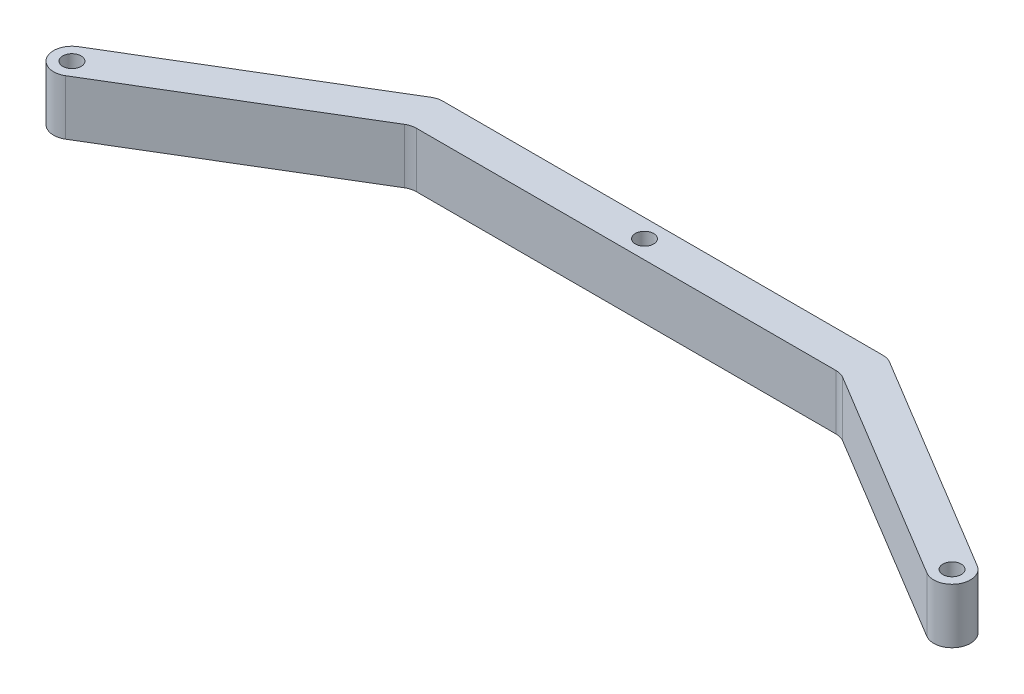
from build123d import *

# Parameters (mm, degrees)
SKETCH1_R           = 2.5
BOSS_EXTRUDE1_DEPTH = 15
SKETCH2_R           = 2.5
CUT_EXTRUDE1_DEPTH  = 20


with BuildPart() as part:
    # Sketch1 → Boss-Extrude1 (new body)
    with BuildSketch(Plane(origin=(0, 0, 0), x_dir=(1, 0, 0), z_dir=(0, 1, 0))):
        with BuildLine():
            Line((-59.967506742, 33.972160861), (59.967506742, 33.972160861))
            ThreePointArc((59.967506742, 33.972160861), (61.305448214, 33.78982758), (62.545809183, 33.256125908))
            Line((62.545809183, 33.256125908), (122.57830244, -2.874403203))
            ThreePointArc((122.57830244, -2.874403203), (124.283965047, -9.736670691), (117.42169756, -11.442333298))
            Line((117.42169756, -11.442333298), (59.768652626, 23.256125908))
            ThreePointArc((59.768652626, 23.256125908), (58.528291658, 23.78982758), (57.190350186, 23.972160861))
            Line((57.190350186, 23.972160861), (-57.190350186, 23.972160861))
            ThreePointArc((-57.190350186, 23.972160861), (-58.528291658, 23.78982758), (-59.768652626, 23.256125908))
            Line((-59.768652626, 23.256125908), (-117.42169756, -11.442333298))
            ThreePointArc((-117.42169756, -11.442333298), (-124.283965047, -9.736670691), (-122.57830244, -2.874403203))
            Line((-122.57830244, -2.874403203), (-62.545809183, 33.256125908))
            ThreePointArc((-62.545809183, 33.256125908), (-61.305448214, 33.78982758), (-59.967506742, 33.972160861))
        make_face()
        with Locations(Location((-120, -7.158368251, 0), (0, 0, 270))):
            Circle(SKETCH1_R, mode=Mode.SUBTRACT)
        with Locations(Location((120, -7.158368251, 0), (0, 0, 90))):
            Circle(SKETCH1_R, mode=Mode.SUBTRACT)
    extrude(amount=BOSS_EXTRUDE1_DEPTH)

    # Sketch2 → Cut-Extrude1 (cut)
    with BuildSketch(Plane(origin=(0, 15, 0), x_dir=(1, 0, 0), z_dir=(0, 1, 0))):
        with Locations(Location((0, 28.972160861, 0), (0, 0, 270))):
            Circle(SKETCH2_R)
    extrude(amount=-CUT_EXTRUDE1_DEPTH, mode=Mode.SUBTRACT)


solid = part.part
